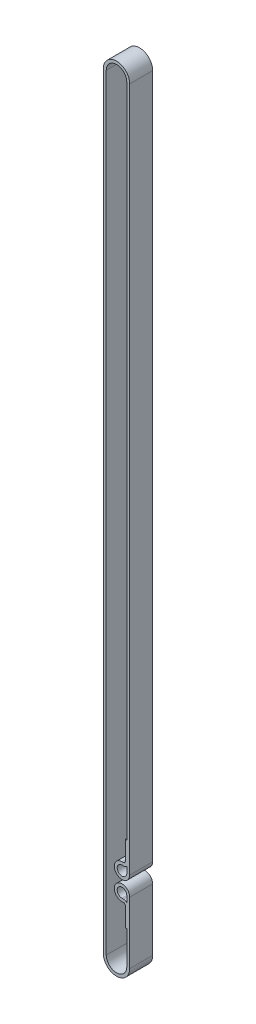
from build123d import *

# Parameters (mm, degrees)
EXTRUDE_THIN1_DEPTH = 12
BOSS_EXTRUDE2_START = -12
BOSS_EXTRUDE2_DEPTH = 12


with BuildPart() as part:
    # Sketch1 → Extrude-Thin1 (new body)
    with BuildSketch(Plane.XY):
        with BuildLine():
            Line((5.107, -342.696), (5.107, -352.696))
            ThreePointArc((5.107, -352.696), (4.667660172, -353.756660172), (3.607, -354.196))
            Line((3.607, -354.196), (2.861, -354.196))
            ThreePointArc((2.861, -354.196), (0.383297839, -360.177702161), (6.365, -357.7))
            Line((6.365, -357.7), (6.365, 0))
            ThreePointArc((6.365, 0), (0, 6.365), (-6.365, 0))
            Line((-6.365, 0), (-6.365, -400))
            ThreePointArc((-6.365, -400), (0, -406.365), (6.365, -400))
            Line((6.365, -400), (6.365, -367.7))
            ThreePointArc((6.365, -367.7), (0.383297839, -365.222297839), (2.861, -371.204))
            Line((2.861, -371.204), (3.607, -371.204))
            ThreePointArc((3.607, -371.204), (4.667660172, -371.643339828), (5.107, -372.704))
            Line((5.107, -372.704), (5.107, -382.704))
            Line((5.107, -382.704), (4.591, -382.704))
            Line((4.591, -382.704), (4.591, -372.704))
            ThreePointArc((4.591, -372.704), (4.302793073, -372.008206927), (3.607, -371.72))
            Line((3.607, -371.72), (2.861, -371.72))
            ThreePointArc((2.861, -371.72), (0.01843074, -364.85743074), (6.881, -367.7))
            Line((6.881, -367.7), (6.881, -400))
            ThreePointArc((6.881, -400), (0, -406.881), (-6.881, -400))
            Line((-6.881, -400), (-6.881, 0))
            ThreePointArc((-6.881, 0), (0, 6.881), (6.881, 0))
            Line((6.881, 0), (6.881, -357.7))
            ThreePointArc((6.881, -357.7), (0.01843074, -360.54256926), (2.861, -353.68))
            Line((2.861, -353.68), (3.607, -353.68))
            ThreePointArc((3.607, -353.68), (4.302793073, -353.391793073), (4.591, -352.696))
            Line((4.591, -352.696), (4.591, -342.696))
            Line((4.591, -342.696), (5.107, -342.696))
        make_face()
    extrude(amount=EXTRUDE_THIN1_DEPTH)

    # Sketch3 → Boss-Extrude2 (add)
    with BuildSketch(Plane.XY.offset(12).offset(BOSS_EXTRUDE2_START)):
        with BuildLine():
            ThreePointArc((-5.361, -400), (0, -405.361), (5.361, -400))
            Line((5.361, -400), (5.361, -382.704))
            Line((5.361, -382.704), (5.107, -382.704))
            Line((5.107, -382.704), (5.107, -372.704))
            ThreePointArc((5.107, -372.704), (4.667660172, -371.643339828), (3.607, -371.204))
            Line((3.607, -371.204), (2.861, -371.204))
            ThreePointArc((2.861, -371.204), (0.383297839, -365.222297839), (6.365, -367.7))
            Line((6.365, -367.7), (6.365, -400))
            ThreePointArc((6.365, -400), (0, -406.365), (-6.365, -400))
            Line((-6.365, -400), (-6.365, 0))
            ThreePointArc((-6.365, 0), (0, 6.365), (6.365, 0))
            Line((6.365, 0), (6.365, -357.7))
            ThreePointArc((6.365, -357.7), (0.383297839, -360.177702161), (2.861, -354.196))
            Line((2.861, -354.196), (3.607, -354.196))
            ThreePointArc((3.607, -354.196), (4.667660172, -353.756660172), (5.107, -352.696))
            Line((5.107, -352.696), (5.107, -342.696))
            Line((5.107, -342.696), (5.361, -342.696))
            Line((5.361, -342.696), (5.361, 0))
            ThreePointArc((5.361, 0), (0, 5.361), (-5.361, 0))
            Line((-5.361, 0), (-5.361, -400))
        make_face()
        with BuildLine():
            ThreePointArc((5.361, -367.7), (1.093233047, -365.932233047), (2.861, -370.2))
            Line((2.861, -370.2), (3.607, -370.2))
            ThreePointArc((3.607, -370.2), (4.554437655, -370.386160944), (5.361, -370.916963347))
            Line((5.361, -370.916963347), (5.361, -367.7))
        make_face(mode=Mode.SUBTRACT)
        with BuildLine():
            ThreePointArc((2.861, -355.2), (1.093233047, -359.467766953), (5.361, -357.7))
            Line((5.361, -357.7), (5.361, -354.483036653))
            ThreePointArc((5.361, -354.483036653), (4.554437655, -355.013839056), (3.607, -355.2))
            Line((3.607, -355.2), (2.861, -355.2))
        make_face(mode=Mode.SUBTRACT)
    extrude(amount=BOSS_EXTRUDE2_DEPTH)


solid = part.part
